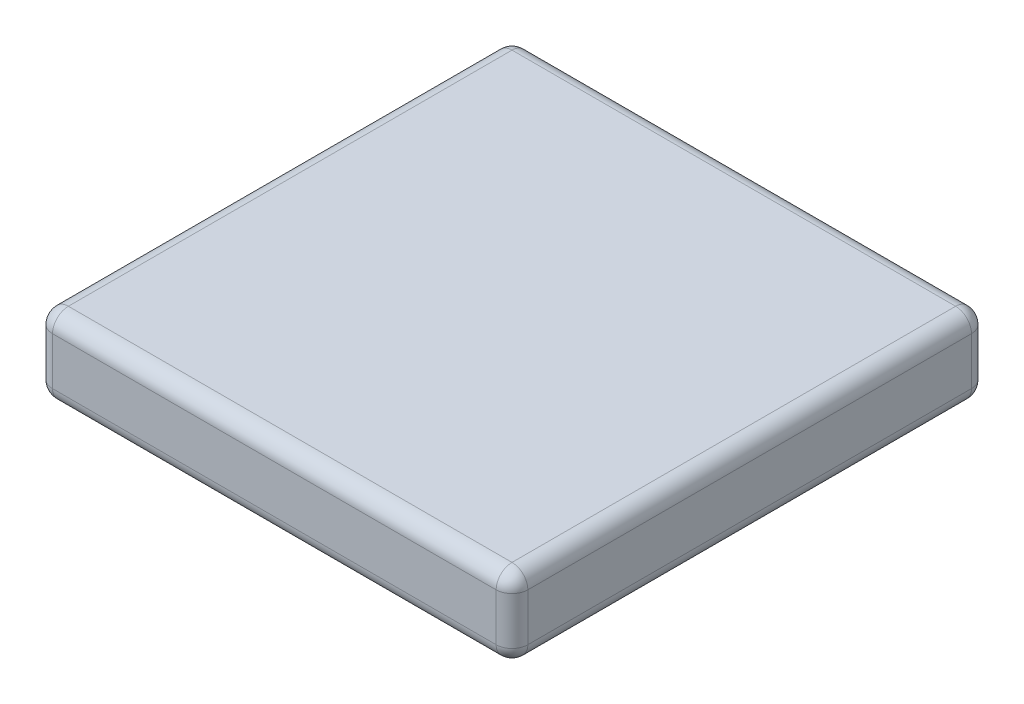
from build123d import *

# Parameters (mm, degrees)
SKETCH1_W           = 30
SKETCH1_H           = 30
BOSS_EXTRUDE1_DEPTH = 5
FILLET1_R           = 1


with BuildPart() as part:
    # Sketch1 → Boss-Extrude1 (new body)
    with BuildSketch(Plane(origin=(0, 0, 0), x_dir=(1, 0, 0), z_dir=(0, 1, 0))):
        with Locations((15, -15)):
            Rectangle(SKETCH1_W, SKETCH1_H)
    extrude(amount=BOSS_EXTRUDE1_DEPTH)

    # Fillet1
    fillet1_edges = [part.edges().sort_by_distance(p)[0] for p in [
        (30, 5, 15),
        (15, 5, 0),
        (0, 5, 15),
        (15, 0, 0),
        (30, 0, 15),
        (15, 0, 30),
        (0, 0, 15),
        (0, 2.5, 0),
        (30, 2.5, 0),
        (30, 2.5, 30),
        (0, 2.5, 30),
        (15, 5, 30),
    ]]
    fillet(fillet1_edges, radius=FILLET1_R)


solid = part.part
